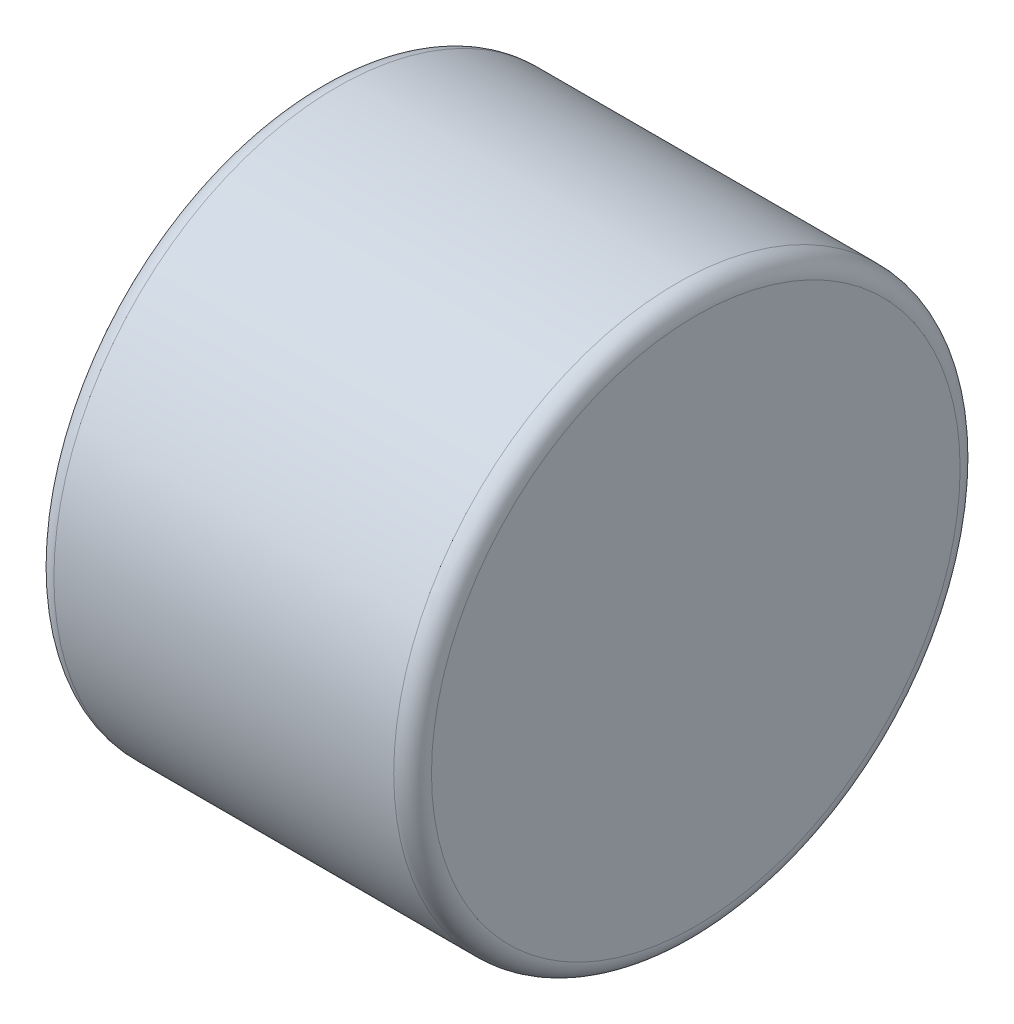
from build123d import *

# Parameters (mm, degrees)
SKETCH1_R           = 3
BOSS_EXTRUDE1_DEPTH = 4
FILLET1_R           = 0.2


with BuildPart() as part:
    # Sketch1 → Boss-Extrude1 (new body)
    with BuildSketch(Plane(origin=(0, 0, 0), x_dir=(0, 0, -1), z_dir=(1, 0, 0))):
        Circle(SKETCH1_R)
    extrude(amount=BOSS_EXTRUDE1_DEPTH)

    # Fillet1
    fillet1_edges = [part.edges().sort_by_distance(p)[0] for p in [
        (0, 0, 3),
        (4, 0, 3),
    ]]
    fillet(fillet1_edges, radius=FILLET1_R)


solid = part.part
